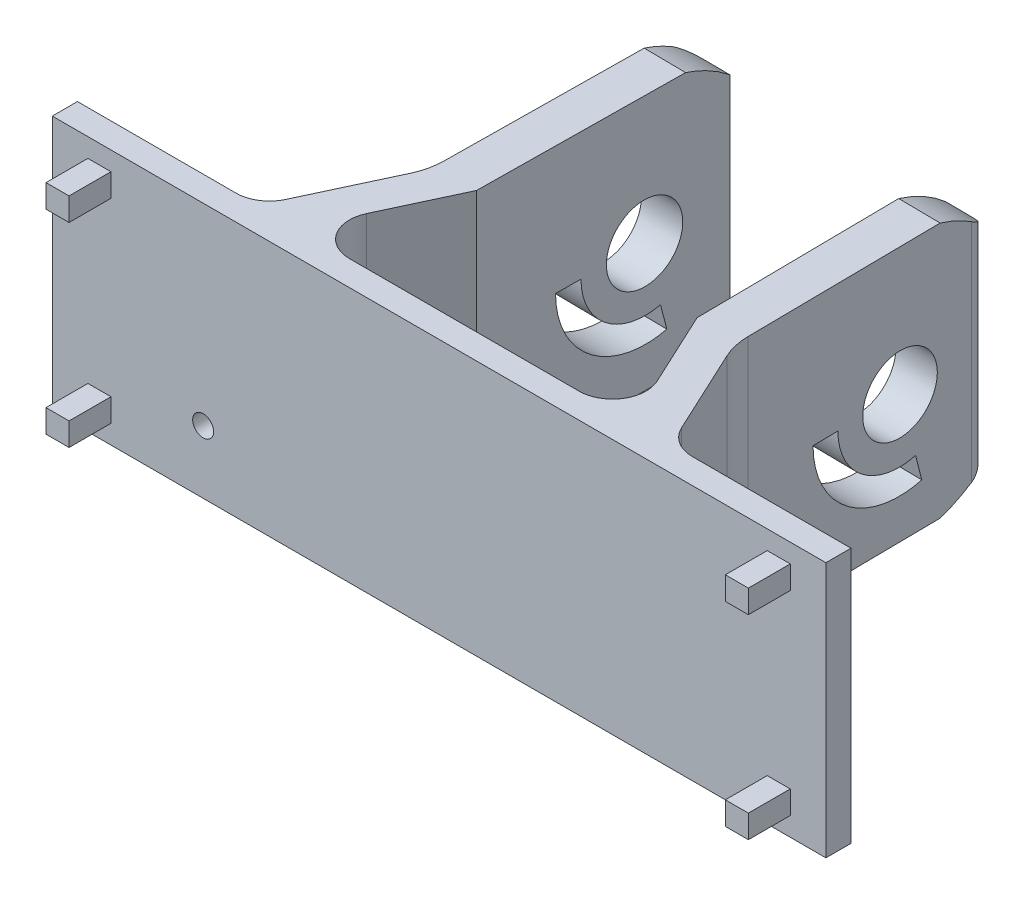
from build123d import *

# Parameters (mm, degrees)
SKETCH1_W           = 92.3
SKETCH1_H           = 30.5
SKETCH1_W_2         = 84.3
SKETCH1_H_2         = 26.5
BOSS_EXTRUDE1_DEPTH = 3
SKETCH2_W           = 3
SKETCH2_H           = 3
BOSS_EXTRUDE2_DEPTH = 5
SKETCH13_W          = 92.3
SKETCH13_H          = 30.5
SKETCH13_W_2        = 83.8
SKETCH13_H_2        = 26
CUT_EXTRUDE9_DEPTH  = 5
SKETCH12_R          = 1.25
CUT_EXTRUDE8_DEPTH  = 12
BOSS_EXTRUDE4_DEPTH = 30.5
FILLET1_R           = 4
SKETCH15_R          = 4.5
CUT_EXTRUDE10_DEPTH = 51


with BuildPart() as part:
    # Sketch1 → Boss-Extrude1 (new body)
    # profile 1 of 2: a face of its own
    with BuildSketch(Plane.XY):
        with Locations((0, 0.6)):
            Rectangle(SKETCH1_W, SKETCH1_H)
        with Locations((0, 0.6)):
            Rectangle(SKETCH1_W_2, SKETCH1_H_2, mode=Mode.SUBTRACT)
    # profile 2 of 2: a face of its own
    with BuildSketch(Plane.XY):
        with Locations((0, 0.6)):
            Rectangle(SKETCH1_W_2, SKETCH1_H_2)
    extrude(amount=BOSS_EXTRUDE1_DEPTH)

    # Sketch2 → Boss-Extrude2 (add)
    with BuildSketch(Plane.XY.offset(3)):
        with Locations((-40.65, 12.35)):
            Rectangle(SKETCH2_W, SKETCH2_H)
        with Locations((40.65, 12.35)):
            Rectangle(SKETCH2_W, SKETCH2_H)
        with Locations((40.65, -11.15)):
            Rectangle(SKETCH2_W, SKETCH2_H)
        with Locations((-40.65, -11.15)):
            Rectangle(SKETCH2_W, SKETCH2_H)
    extrude(amount=BOSS_EXTRUDE2_DEPTH)

    # Sketch13 → Cut-Extrude9 (cut)
    with BuildSketch(Plane.XY.offset(8)):
        with Locations((0, 0.6)):
            Rectangle(SKETCH13_W, SKETCH13_H)
        with Locations((0, 0.6)):
            Rectangle(SKETCH13_W_2, SKETCH13_H_2, mode=Mode.SUBTRACT)
    extrude(amount=-CUT_EXTRUDE9_DEPTH, mode=Mode.SUBTRACT)

    # Sketch12 → Cut-Extrude8 (cut)
    with BuildSketch(Plane.XY.offset(3)):
        with Locations((-28.15, -7.15)):
            Circle(SKETCH12_R)
    extrude(amount=-CUT_EXTRUDE8_DEPTH, mode=Mode.SUBTRACT)

    # Sketch14 → Boss-Extrude4 (add)
    with BuildSketch(Plane(origin=(0, 15.85, 0), x_dir=(1, 0, 0), z_dir=(0, 1, 0))):
        with BuildLine():
            Line((12.799828546, 44.630563997), (13.151366909, 14.632623721))
            Line((13.151366909, 14.632623721), (19.974671409, 0))
            Line((19.974671409, 0), (24.687430993, 0))
            Line((24.687430993, 0), (18.887905283, 12.437123022))
            ThreePointArc((18.887905283, 12.437123022), (18.338278668, 14.040820406), (18.138916839, 15.724325552))
            Line((18.138916839, 15.724325552), (17.823136491, 42.670915272))
            ThreePointArc((17.823136491, 42.670915272), (17.22518506, 44.073889153), (15.812063723, 44.647447965))
            Line((15.812063723, 44.647447965), (12.799828546, 44.630563997))
        make_face()
        with BuildLine():
            Line((-13.151397234, 14.632558688), (-12.798784772, 44.487080457))
            Line((-12.798784772, 44.487080457), (-15.83402069, 44.470067567))
            ThreePointArc((-15.83402069, 44.470067567), (-17.23263166, 43.888691454), (-17.822671194, 42.493713254))
            Line((-17.822671194, 42.493713254), (-18.138767444, 15.72395041))
            ThreePointArc((-18.138767444, 15.72395041), (-18.338200149, 14.040810917), (-18.887747495, 12.4374614))
            Line((-18.887747495, 12.4374614), (-24.687430993, 0))
            Line((-24.687430993, 0), (-19.974671409, 0))
            Line((-19.974671409, 0), (-13.151397234, 14.632558688))
        make_face()
    extrude(amount=-BOSS_EXTRUDE4_DEPTH)

    # Fillet1
    fillet1_edges = [part.edges().sort_by_distance(p)[0] for p in [
        (24.687430993, 0.6, 0),
        (19.974671409, 0.6, 0),
        (-19.974671409, 0.6, 0),
        (-24.687430993, 0.6, 0),
    ]]
    fillet(fillet1_edges, radius=FILLET1_R)

    # Sketch15 → Cut-Extrude10 (cut)
    with BuildSketch(Plane(origin=(-18.321880618, 0, -0.216344007), x_dir=(-0.011807135462763681, 0, 0.9999302933465732), z_dir=(-0.9999302933465732, 0, -0.011807135462763681))):
        with Locations((-34.28001328, 0.6)):
            Circle(SKETCH15_R)
        with BuildLine():
            Line((-39.121242463, 15.85), (-39.121242463, 17.869989606))
            Line((-39.121242463, 17.869989606), (-55.967413811, 17.869989606))
            Line((-55.967413811, 17.869989606), (-55.967413811, -17.820804899))
            Line((-55.967413811, -17.820804899), (-39.121242463, -17.820804899))
            Line((-39.121242463, -17.820804899), (-39.121242463, -14.65))
            ThreePointArc((-39.121242463, -14.65), (-50.28001328, 0.6), (-39.121242463, 15.85))
        make_face()
        with BuildLine():
            Line((-36.156004252, -6.661587834), (-36.90640064, -9.566222968))
            ThreePointArc((-36.90640064, -9.566222968), (-27.850669118, -7.701417568), (-23.78001328, 0.6))
            Line((-23.78001328, 0.6), (-26.78001328, 0.6))
            ThreePointArc((-26.78001328, 0.6), (-29.687624593, -5.329583977), (-36.156004252, -6.661587834))
        make_face()
    extrude(amount=-CUT_EXTRUDE10_DEPTH, mode=Mode.SUBTRACT)


solid = part.part
